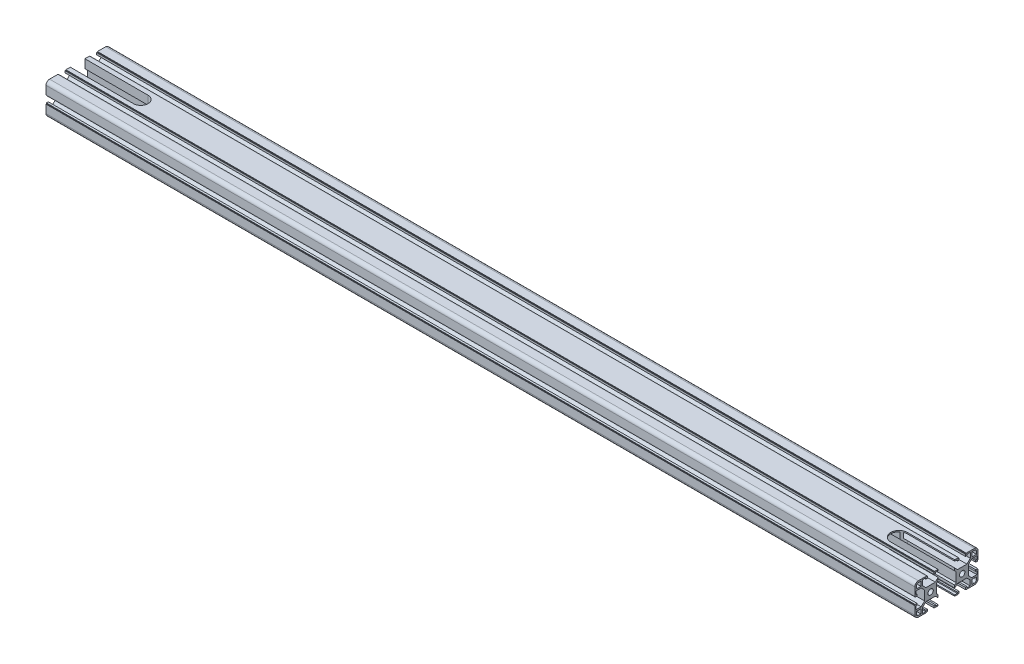
from build123d import *

# Parameters (mm, degrees)
SKETCH1_R                 = 3.4
F_40_X_80W_X_R4_5_1_DEPTH = 1100
CUT_EXTRUDE_1_REACH       = 556.707
CUT_EXTRUDE_2_DEPTH       = 555.707255189


with BuildPart() as part:
    # Sketch1 → 工业铝型材 40 X 80W X R4.5(1) (new body)
    with BuildSketch(Plane.YZ.offset(-550)):
        with BuildLine():
            Line((-5.1, 20), (-5.1, 19.5))
            Line((-5.1, 19.5), (-4.1, 19.5))
            Line((-4.1, 19.5), (-4.1, 17))
            Line((-4.1, 17), (-6.1, 17))
            Line((-6.1, 17), (-6.1, 18.5))
            Line((-6.1, 18.5), (-10.3, 18.5))
            Line((-10.3, 18.5), (-10.3, 12))
            Line((-10.3, 12), (-6, 7.7))
            Line((-6, 7.7), (6, 7.7))
            Line((6, 7.7), (10.3, 12))
            Line((10.3, 12), (10.3, 18.5))
            Line((10.3, 18.5), (6.1, 18.5))
            Line((6.1, 18.5), (6.1, 17))
            Line((6.1, 17), (4.1, 17))
            Line((4.1, 17), (4.1, 19.5))
            Line((4.1, 19.5), (5.1, 19.5))
            Line((5.1, 19.5), (5.1, 20))
            Line((5.1, 20), (15.5, 20))
            ThreePointArc((15.5, 20), (18.681980515, 18.681980515), (20, 15.5))
            Line((20, 15.5), (20, 5.1))
            Line((20, 5.1), (19.5, 5.1))
            Line((19.5, 5.1), (19.5, 4.1))
            Line((19.5, 4.1), (17, 4.1))
            Line((17, 4.1), (17, 6.1))
            Line((17, 6.1), (18.5, 6.1))
            Line((18.5, 6.1), (18.5, 10.3))
            Line((18.5, 10.3), (12, 10.3))
            Line((12, 10.3), (7.7, 6))
            Line((7.7, 6), (7.7, -6))
            Line((7.7, -6), (12, -10.3))
            Line((12, -10.3), (18.5, -10.3))
            Line((18.5, -10.3), (18.5, -6.1))
            Line((18.5, -6.1), (17, -6.1))
            Line((17, -6.1), (17, -4.1))
            Line((17, -4.1), (19.5, -4.1))
            Line((19.5, -4.1), (19.5, -5.1))
            Line((19.5, -5.1), (20, -5.1))
            Line((20, -5.1), (20, -34.900262163))
            Line((20, -34.900262163), (19.375005498, -34.897640542))
            Line((19.375005498, -34.897640542), (19.370810904, -35.897631745))
            Line((19.370810904, -35.897631745), (16.870832898, -35.88714526))
            Line((16.870832898, -35.88714526), (16.879222086, -33.887162854))
            Line((16.879222086, -33.887162854), (18.37920889, -33.893454745))
            Line((18.37920889, -33.893454745), (18.396826184, -29.693491694))
            Line((18.396826184, -29.693491694), (11.896883367, -29.666226833))
            Line((11.896883367, -29.666226833), (7.578884442, -33.948152251))
            Line((7.578884442, -33.948152251), (7.528549314, -45.948046683))
            Line((7.528549314, -45.948046683), (11.810474731, -50.266045608))
            Line((11.810474731, -50.266045608), (18.310417549, -50.293310469))
            Line((18.310417549, -50.293310469), (18.328034843, -46.093347418))
            Line((18.328034843, -46.093347418), (16.828048039, -46.087055527))
            Line((16.828048039, -46.087055527), (16.836437227, -44.087073122))
            Line((16.836437227, -44.087073122), (19.336415234, -44.097559606))
            Line((19.336415234, -44.097559606), (19.33222064, -45.097550809))
            Line((19.33222064, -45.097550809), (20, -45.100351897))
            Line((20, -45.100351897), (20, -55.5))
            ThreePointArc((20, -55.5), (18.681980515, -58.681980515), (15.5, -60))
            Line((15.5, -60), (5.1, -60))
            Line((5.1, -60), (5.1, -59.5))
            Line((5.1, -59.5), (4.1, -59.5))
            Line((4.1, -59.5), (4.1, -57))
            Line((4.1, -57), (6.1, -57))
            Line((6.1, -57), (6.1, -58.5))
            Line((6.1, -58.5), (10.3, -58.5))
            Line((10.3, -58.5), (10.3, -52))
            Line((10.3, -52), (6, -47.7))
            Line((6, -47.7), (-6, -47.7))
            Line((-6, -47.7), (-10.3, -52))
            Line((-10.3, -52), (-10.3, -58.5))
            Line((-10.3, -58.5), (-6.1, -58.5))
            Line((-6.1, -58.5), (-6.1, -57))
            Line((-6.1, -57), (-4.1, -57))
            Line((-4.1, -57), (-4.1, -59.5))
            Line((-4.1, -59.5), (-5.1, -59.5))
            Line((-5.1, -59.5), (-5.1, -60))
            Line((-5.1, -60), (-15.5, -60))
            ThreePointArc((-15.5, -60), (-18.727003145, -58.638097654), (-20, -55.375))
            Line((-20, -55.375), (-20, -44.975))
            Line((-20, -44.975), (-19.5, -44.975))
            Line((-19.5, -44.975), (-19.5, -43.975))
            Line((-19.5, -43.975), (-17, -43.975))
            Line((-17, -43.975), (-17, -45.975))
            Line((-17, -45.975), (-18.5, -45.975))
            Line((-18.5, -45.975), (-18.5, -50.175))
            Line((-18.5, -50.175), (-12, -50.175))
            Line((-12, -50.175), (-7.7, -45.875))
            Line((-7.7, -45.875), (-7.7, -33.875))
            Line((-7.7, -33.875), (-12, -29.575))
            Line((-12, -29.575), (-18.5, -29.575))
            Line((-18.5, -29.575), (-18.5, -33.775))
            Line((-18.5, -33.775), (-17, -33.775))
            Line((-17, -33.775), (-17, -35.775))
            Line((-17, -35.775), (-19.5, -35.775))
            Line((-19.5, -35.775), (-19.5, -34.775))
            Line((-19.5, -34.775), (-20, -34.775))
            Line((-20, -34.775), (-20, -5.1))
            Line((-20, -5.1), (-19.5, -5.1))
            Line((-19.5, -5.1), (-19.5, -4.1))
            Line((-19.5, -4.1), (-17, -4.1))
            Line((-17, -4.1), (-17, -6.1))
            Line((-17, -6.1), (-18.5, -6.1))
            Line((-18.5, -6.1), (-18.5, -10.3))
            Line((-18.5, -10.3), (-12, -10.3))
            Line((-12, -10.3), (-7.7, -6))
            Line((-7.7, -6), (-7.7, 6))
            Line((-7.7, 6), (-12, 10.3))
            Line((-12, 10.3), (-18.5, 10.3))
            Line((-18.5, 10.3), (-18.5, 6.1))
            Line((-18.5, 6.1), (-17, 6.1))
            Line((-17, 6.1), (-17, 4.1))
            Line((-17, 4.1), (-19.5, 4.1))
            Line((-19.5, 4.1), (-19.5, 5.1))
            Line((-19.5, 5.1), (-20, 5.1))
            Line((-20, 5.1), (-20, 15.5))
            ThreePointArc((-20, 15.5), (-18.681980515, 18.681980515), (-15.5, 20))
            Line((-15.5, 20), (-5.1, 20))
        make_face()
        Circle(SKETCH1_R, mode=Mode.SUBTRACT)
        with Locations((0, -40)):
            Circle(SKETCH1_R, mode=Mode.SUBTRACT)
        with BuildLine():
            Line((12.3, 18), (15.5, 18))
            ThreePointArc((15.5, 18), (17.267766953, 17.267766953), (18, 15.5))
            Line((18, 15.5), (18, 12.3))
            Line((18, 12.3), (12.3, 12.3))
            Line((12.3, 12.3), (12.3, 18))
        make_face(mode=Mode.SUBTRACT)
        Polygon((10.325, -12.025), (6, -7.7), (-6, -7.7), (-10.325, -12.025), (-18.5, -12.025), (-18.5, -28), (-10.3, -28), (-6, -32.3), (6, -32.3), (10.3, -28), (18.5, -28), (18.5, -12.025), align=None, mode=Mode.SUBTRACT)
        with BuildLine():
            Line((-15.5, 18), (-12.3, 18))
            Line((-12.3, 18), (-12.3, 12.3))
            Line((-12.3, 12.3), (-18, 12.3))
            Line((-18, 12.3), (-18, 15.5))
            ThreePointArc((-18, 15.5), (-17.267766953, 17.267766953), (-15.5, 18))
        make_face(mode=Mode.SUBTRACT)
        with BuildLine():
            Line((-12.301736455, -58.000000335), (-12.301736455, -52.300000335))
            Line((-12.301736455, -52.300000335), (-18.001736455, -52.300000335))
            Line((-18.001736455, -52.300000335), (-18.001736455, -55.500000335))
            ThreePointArc((-18.001736455, -55.500000335), (-17.269503408, -57.267767288), (-15.501736455, -58.000000335))
            Line((-15.501736455, -58.000000335), (-12.301736455, -58.000000335))
        make_face(mode=Mode.SUBTRACT)
        with BuildLine():
            Line((18, -55.5), (18, -52.3))
            Line((18, -52.3), (12.3, -52.3))
            Line((12.3, -52.3), (12.3, -58))
            Line((12.3, -58), (15.5, -58))
            ThreePointArc((15.5, -58), (17.267766953, -57.267766953), (18, -55.5))
        make_face(mode=Mode.SUBTRACT)
    extrude(amount=F_40_X_80W_X_R4_5_1_DEPTH)

    # 草图3 → 切除-拉伸1 (cut, up to next)
    with BuildSketch(Plane(origin=(0, 20, 0), x_dir=(1, 0, 0), z_dir=(0, 1, 0)), mode=Mode.PRIVATE) as cut_extrude_1_sk1:
        with BuildLine():
            Line((-550, 29.250131082), (-470, 29.250131082))
            ThreePointArc((-470, 29.250131082), (-460.75, 20.000131082), (-470, 10.750131082))
            Line((-470, 10.750131082), (-550, 10.750131082))
            ThreePointArc((-550, 10.750131082), (-559.25, 20.000131082), (-550, 29.250131082))
        make_face()
    cut_extrude_1_tool1 = extrude(cut_extrude_1_sk1.sketch, amount=-CUT_EXTRUDE_1_REACH, mode=Mode.PRIVATE) & part.part
    add(cut_extrude_1_tool1.solids().sort_by_distance((-510, 20, -20.000131))[0], mode=Mode.SUBTRACT)

    # 草图4 → 切除-拉伸2 (cut, through all)
    with BuildSketch(Plane(origin=(0, 20, 0), x_dir=(1, 0, 0), z_dir=(0, 1, 0))):
        with BuildLine():
            Line((550, 9.500131082), (490, 9.500131082))
            ThreePointArc((490, 9.500131082), (479.5, 20.000131082), (490, 30.500131082))
            Line((490, 30.500131082), (550, 30.500131082))
            ThreePointArc((550, 30.500131082), (560.5, 20.000131082), (550, 9.500131082))
        make_face()
    extrude(amount=-CUT_EXTRUDE_2_DEPTH, mode=Mode.SUBTRACT)


solid = part.part
